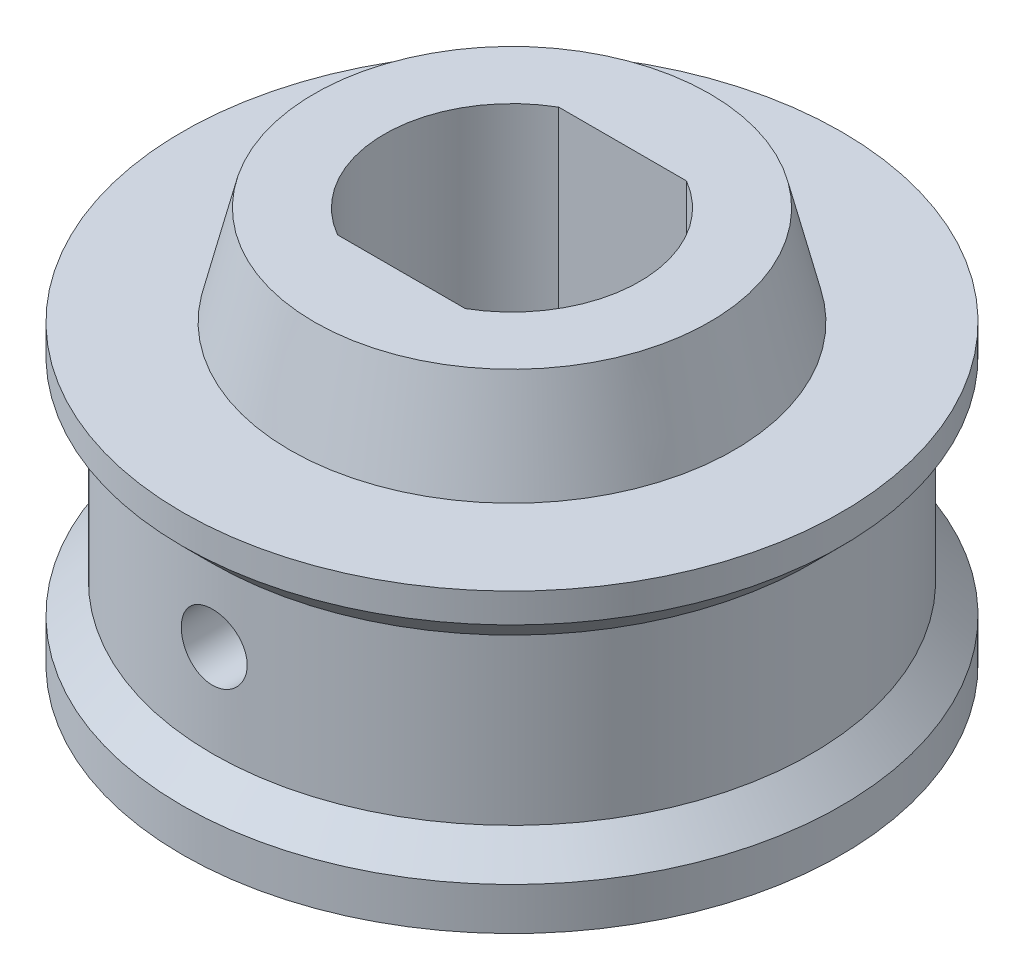
from build123d import *

# Parameters (mm, degrees)
CUT_EXTRUDE1_DEPTH      = 21
CUT_EXTRUDE2_DEPTH      = 19.547236991
CUT_EXTRUDE2_DEPTH_BACK = 19.547236991
SKETCH6_R               = 1


with BuildPart() as part:
    # Sketch4 → Revolve1 (revolve)
    with BuildSketch(Plane.XY, mode=Mode.PRIVATE) as revolve1_sk:
        Polygon((0, 0), (10, 0), (10, 1.289403445), (9.090035529, 2.199367917), (9.090035529, 7.199367917), (10, 8.109332388), (10, 9), (6.735647112, 9), (6, 12), (0, 12), (0, 9), align=None)
    revolve(revolve1_sk.sketch.rotate(Axis((0, 9, 0), (0, -1, 0)), 90), axis=Axis((0, 9, 0), (0, -1, 0)))

    # Sketch5 → Cut-Extrude1 (cut)
    with BuildSketch(Plane(origin=(0, 12, 0), x_dir=(1, 0, 0), z_dir=(0, 1, 0))):
        with BuildLine():
            Line((1.9375, 3.35584844), (-1.9375, 3.35584844))
            ThreePointArc((-1.9375, 3.35584844), (-3.875, 0), (-1.9375, -3.35584844))
            Line((-1.9375, -3.35584844), (1.9375, -3.35584844))
            ThreePointArc((1.9375, -3.35584844), (3.875, 0), (1.9375, 3.35584844))
        make_face()
    extrude(amount=-CUT_EXTRUDE1_DEPTH, mode=Mode.SUBTRACT)

    # Sketch6 → Cut-Extrude2 (cut, two sides: drawn at the far end of the back side and taken through both)
    with BuildSketch(Plane.XY.offset(-CUT_EXTRUDE2_DEPTH_BACK)):
        with Locations((0, 5)):
            Circle(SKETCH6_R)
    extrude(amount=CUT_EXTRUDE2_DEPTH + CUT_EXTRUDE2_DEPTH_BACK, mode=Mode.SUBTRACT)


solid = part.part
